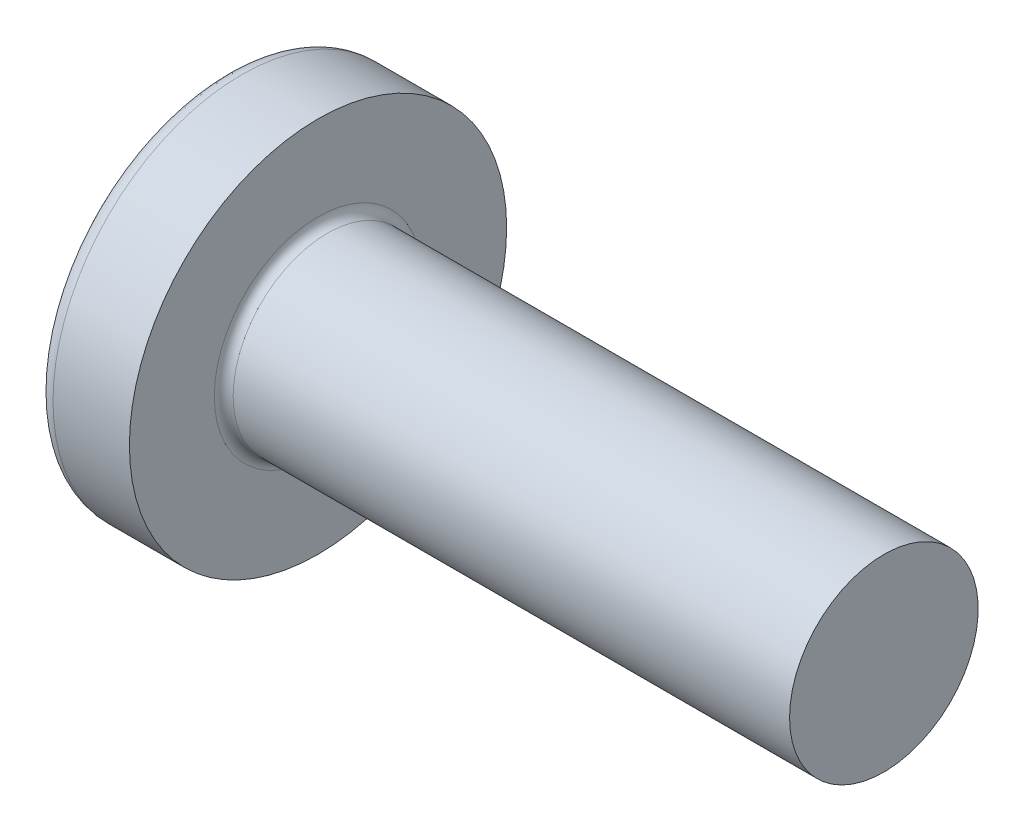
from build123d import *

# Parameters (mm, degrees)
FILLET1_R    = 0.1
RECPAT_COUNT = 2
RECPAT_ANGLE = 90


with BuildPart() as part:
    # BodySke → Base-Revolve (revolve)
    with BuildSketch(Plane.XY, mode=Mode.PRIVATE) as base_revolve_sk:
        with BuildLine():
            Line((1.6, 1), (1.6, 2))
            Line((1.6, 2), (0.790020747, 2))
            ThreePointArc((0.790020747, 2), (0.709789294, 1.981130115), (0.646379599, 1.928476821))
            ThreePointArc((0.646379599, 1.928476821), (0.165895084, 1.016959861), (0, 0))
            Line((0, 0), (7.6, 0))
            Line((7.6, 0), (7.6, 1))
            Line((7.6, 1), (1.6, 1))
        make_face()
    revolve(base_revolve_sk.sketch.rotate(Axis((0.790020747, 0, 0), (1, 0, 0)), 90), axis=Axis((0.790020747, 0, 0), (1, 0, 0)))

    # Fillet1
    fillet1_edges = [part.edges().sort_by_distance(p)[0] for p in [
        (1.6, 0, -1),
    ]]
    fillet(fillet1_edges, radius=FILLET1_R)

    # Sketch3 → Recess section 0
    with BuildSketch(Plane(origin=(0, 0, 0), x_dir=(0, 0, -1), z_dir=(1, 0, 0))):
        with BuildLine():
            Line((0.24, -1.05), (-0.24, -1.05))
            Line((-0.24, -1.05), (-0.24, 1.05))
            Line((-0.24, 1.05), (0.24, 1.05))
            Line((0.24, 1.05), (0.24, -1.05))
        make_face()
    # Sketch4 → Recess section 1
    with BuildSketch(Plane(origin=(1.42, 0, 0), x_dir=(0, 0, -1), z_dir=(1, 0, 0))):
        with BuildLine():
            Line((0.24, -0.342014235), (-0.24, -0.342014235))
            Line((-0.24, -0.342014235), (-0.24, 0.342014235))
            Line((-0.24, 0.342014235), (0.24, 0.342014235))
            Line((0.24, 0.342014235), (0.24, -0.342014235))
        make_face()
    recess = loft(mode=Mode.SUBTRACT)

    # RecPat: Recess ×2 about axis
    recpat_axis = Axis((0, 0, 0), (1, 0, 0))
    for i in range(1, RECPAT_COUNT):
        add(recess.rotate(recpat_axis, i * RECPAT_ANGLE / (RECPAT_COUNT - 1)), mode=Mode.SUBTRACT)

    # RecCorSke → RecessCore (revolve, cut)
    with BuildSketch(Plane.XY, mode=Mode.PRIVATE) as recesscore_sk:
        Polygon((0, 0), (0, 0.454796073), (1.42, 0.3555), (1.535508952, 0), align=None)
    revolve(recesscore_sk.sketch.rotate(Axis((-3.175, 0, 0), (1, 0, 0)), 13.894577695), axis=Axis((-3.175, 0, 0), (1, 0, 0)), mode=Mode.SUBTRACT)


solid = part.part
